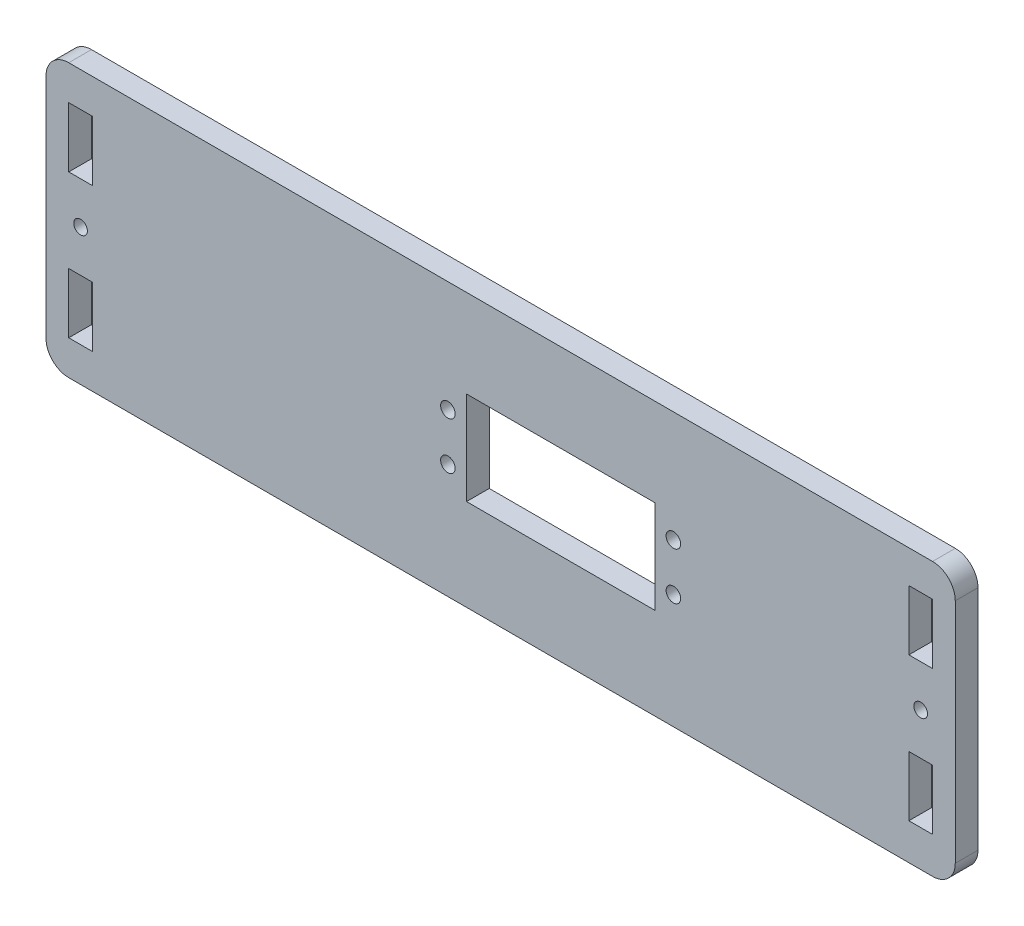
from build123d import *

# Parameters (mm, degrees)
SKETCH1_R           = 1.6
SKETCH1_R_2         = 1.5
SKETCH1_W           = 5.2
SKETCH1_H           = 13.2
SKETCH1_W_2         = 41.4
SKETCH1_H_2         = 20.5
BOSS_EXTRUDE1_DEPTH = 5


with BuildPart() as part:
    # Sketch1 → Boss-Extrude1 (new body)
    with BuildSketch(Plane.XY):
        with BuildLine():
            Line((-36.027647281, 22.573731276), (153.972352719, 22.573731276))
            ThreePointArc((153.972352719, 22.573731276), (157.507886625, 21.109265182), (158.972352719, 17.573731276))
            Line((158.972352719, 17.573731276), (158.972352719, -32.426268724))
            ThreePointArc((158.972352719, -32.426268724), (157.507886625, -35.96180263), (153.972352719, -37.426268724))
            Line((153.972352719, -37.426268724), (-36.027647281, -37.426268724))
            ThreePointArc((-36.027647281, -37.426268724), (-39.563181187, -35.96180263), (-41.027647281, -32.426268724))
            Line((-41.027647281, -32.426268724), (-41.027647281, 17.573731276))
            ThreePointArc((-41.027647281, 17.573731276), (-39.563181187, 21.109265182), (-36.027647281, 22.573731276))
        make_face()
        with Locations((47.372352719, -1.826397645)):
            Circle(SKETCH1_R, mode=Mode.SUBTRACT)
        with Locations((47.372352719, -12.226397645)):
            Circle(SKETCH1_R, mode=Mode.SUBTRACT)
        with Locations((96.972352719, -12.226397645)):
            Circle(SKETCH1_R, mode=Mode.SUBTRACT)
        with Locations((96.972352719, -1.826397645)):
            Circle(SKETCH1_R, mode=Mode.SUBTRACT)
        with Locations((151.369386748, -7.026268724)):
            Circle(SKETCH1_R_2, mode=Mode.SUBTRACT)
        with Locations(Location((-33.42468131, -7.426268724, 0), (0, 0, 180))):
            Circle(SKETCH1_R_2, mode=Mode.SUBTRACT)
        with Locations((-33.42468131, 8.373731276)):
            Rectangle(SKETCH1_W, SKETCH1_H, mode=Mode.SUBTRACT)
        with Locations((151.369386748, -22.826268724)):
            Rectangle(SKETCH1_W, SKETCH1_H, mode=Mode.SUBTRACT)
        with Locations((151.369386748, 8.773731276)):
            Rectangle(SKETCH1_W, SKETCH1_H, mode=Mode.SUBTRACT)
        with Locations((72.172352719, -7.026268724)):
            Rectangle(SKETCH1_W_2, SKETCH1_H_2, mode=Mode.SUBTRACT)
        with Locations((-33.42468131, -23.226268724)):
            Rectangle(SKETCH1_W, SKETCH1_H, mode=Mode.SUBTRACT)
    extrude(amount=BOSS_EXTRUDE1_DEPTH)


solid = part.part
